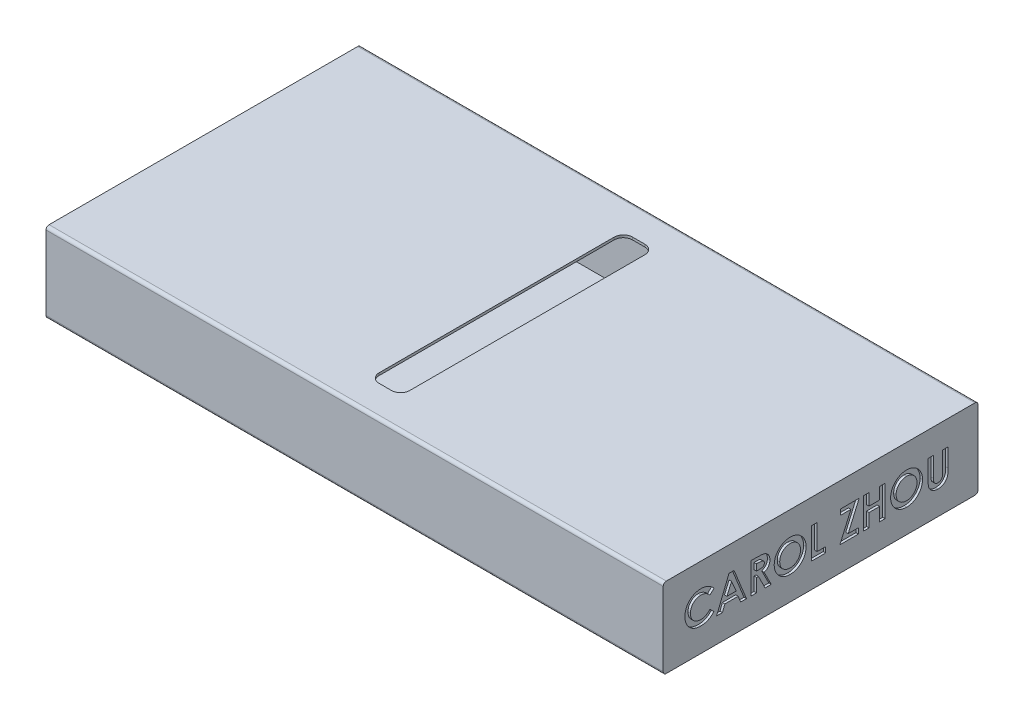
from build123d import *

# Parameters (mm, degrees)
SKETCH1_W           = 102.6
SKETCH1_H           = 26.1
BOSS_EXTRUDE1_DEPTH = 1.2
SKETCH2_W           = 102.6
SKETCH2_H           = 26.1
SKETCH2_W_2         = 101
SKETCH2_H_2         = 24.5
BOSS_EXTRUDE2_DEPTH = 200
CUT_EXTRUDE1_DEPTH  = 0.8
SKETCH4_W           = 10
SKETCH4_H           = 82.6
CUT_EXTRUDE3_DEPTH  = 0.8
FILLET1_R           = 3
FILLET2_R           = 1


with BuildPart() as part:
    # Sketch1 → Boss-Extrude1 (new body)
    with BuildSketch(Plane(origin=(0, 0, 0), x_dir=(0, 0, -1), z_dir=(1, 0, 0))):
        Rectangle(SKETCH1_W, SKETCH1_H)
    extrude(amount=BOSS_EXTRUDE1_DEPTH)

    # Sketch2 → Boss-Extrude2 (add)
    with BuildSketch(Plane.ZY):
        Rectangle(SKETCH2_W, SKETCH2_H)
        Rectangle(SKETCH2_W_2, SKETCH2_H_2, mode=Mode.SUBTRACT)
    extrude(amount=BOSS_EXTRUDE2_DEPTH)

    # Sketch3 → Cut-Extrude1 (cut)
    # profile 1 of 9: a face of its own
    with BuildSketch(Plane(origin=(1.2, 0, 0), x_dir=(0, 0, -1), z_dir=(1, 0, 0))):
        with BuildLine():
            Line((-34.743589744, 3.265224359), (-36.059695513, 2.007211538))
            add(Edge.make_bspline(
                [(-36.059695513, 2.007211538), (-36.171338326, 2.122650395), (-36.389411717, 2.348138647), (-36.740810017, 2.646665221), (-37.106251455, 2.895446728), (-37.478627096, 3.104968929), (-37.864634899, 3.263487407), (-38.259811562, 3.379002492), (-38.666680406, 3.449427674), (-38.94203359, 3.457485561), (-39.080528846, 3.461538462)],
                knots=[0, 0, 0, 0, 1.115251505, 2.178435587, 3.19620269, 4.182487026, 5.141301733, 6.088180966, 7.038406374, 8, 8, 8, 8], degree=3))
            add(Edge.make_bspline(
                [(-39.080528846, 3.461538462), (-39.196189215, 3.458336528), (-39.424432211, 3.452017866), (-39.759552739, 3.405695837), (-40.080112844, 3.32692321), (-40.387209853, 3.21835994), (-40.679940121, 3.077884829), (-40.958917392, 2.905606604), (-41.22345386, 2.70308118), (-41.470055151, 2.471356434), (-41.695637346, 2.218179736), (-41.894953579, 1.948040802), (-42.061912896, 1.661558508), (-42.198933692, 1.361634133), (-42.305667595, 1.046879481), (-42.381889012, 0.717506456), (-42.425973442, 0.3731228), (-42.432553339, 0.139013357), (-42.435897436, 0.020032051)],
                knots=[0, 0, 0, 0, 1.035432265, 2.043311493, 3.022114605, 3.98653278, 4.95457646, 5.923598177, 6.917315552, 7.932509744, 8.948865224, 9.949768934, 10.933144597, 11.912367597, 12.897413939, 13.903909035, 14.934704909, 16, 16, 16, 16], degree=3))
            add(Edge.make_bspline(
                [(-42.435897436, 0.020032051), (-42.434933705, -0.063477354), (-42.433034172, -0.228076108), (-42.412240426, -0.471563347), (-42.378757591, -0.707803533), (-42.330299632, -0.936438823), (-42.269702479, -1.157667356), (-42.198608221, -1.373397658), (-42.10942152, -1.580648823), (-42.010422936, -1.781827939), (-41.895288723, -1.971445581), (-41.771152803, -2.152261739), (-41.636547664, -2.323390071), (-41.490601462, -2.484130999), (-41.331260185, -2.631972502), (-41.162642217, -2.771360351), (-40.981903204, -2.898805194), (-40.792797554, -3.017505401), (-40.593691634, -3.120621281), (-40.389987649, -3.214024347), (-40.178597036, -3.289881523), (-39.962093602, -3.351029328), (-39.741251054, -3.403026403), (-39.513909348, -3.435042601), (-39.282039251, -3.459288092), (-39.125333984, -3.46078511), (-39.046474359, -3.461538462)],
                knots=[0, 0, 0, 0, 1.103660481, 2.175337485, 3.227646561, 4.255952547, 5.262355991, 6.258840057, 7.255597736, 8.242457506, 9.22035537, 10.185017736, 11.140346927, 12.096287581, 13.051739095, 14.01125915, 14.986044842, 15.97314143, 16.960198552, 17.947847494, 18.933482797, 19.925264591, 20.920966487, 21.929612487, 22.958107872, 24, 24, 24, 24], degree=3))
            add(Edge.make_bspline(
                [(-39.046474359, -3.461538462), (-38.912714882, -3.457669428), (-38.649912293, -3.450067782), (-38.264211705, -3.390623991), (-37.89667747, -3.292842318), (-37.603019375, -3.177367843), (-37.372946014, -3.063335301), (-37.197794566, -2.957860815), (-37.016674317, -2.839876021), (-36.83259352, -2.704928047), (-36.643481631, -2.554636322), (-36.452676911, -2.385709176), (-36.255294726, -2.203709139), (-36.125991613, -2.073812136), (-36.059695513, -2.007211538)],
                knots=[0, 0, 0, 0, 1.404581149, 2.759636711, 4.088442092, 5.392261763, 6.066678138, 6.783632037, 7.538459478, 8.336747902, 9.180226004, 10.074962426, 11.012997595, 12, 12, 12, 12], degree=3))
            Line((-36.059695513, -2.007211538), (-34.783653846, -3.347355769))
            add(Edge.make_bspline(
                [(-34.783653846, -3.347355769), (-34.873352707, -3.433957203), (-35.0484257, -3.602984682), (-35.312518451, -3.84298793), (-35.57627883, -4.058657528), (-35.833334937, -4.257821337), (-36.087897619, -4.434677233), (-36.339939879, -4.589401843), (-36.586608489, -4.725908376), (-36.833025603, -4.841894718), (-37.080724553, -4.940379168), (-37.335577665, -5.025167815), (-37.598364048, -5.09689596), (-37.870688681, -5.154771154), (-38.150011485, -5.201179245), (-38.438946552, -5.232504439), (-38.735661891, -5.253563324), (-38.936928502, -5.255455639), (-39.038461538, -5.256410256)],
                knots=[0, 0, 0, 0, 1.244526981, 2.429050516, 3.560637417, 4.644440555, 5.67424972, 6.652764056, 7.595344123, 8.486817594, 9.369275933, 10.254498637, 11.166417451, 12.086725134, 13.032340136, 13.991389299, 14.986715468, 16, 16, 16, 16], degree=3))
            add(Edge.make_bspline(
                [(-39.038461538, -5.256410256), (-39.22496515, -5.251655907), (-39.589900875, -5.242352968), (-40.124704666, -5.173424486), (-40.632753911, -5.057867099), (-41.115284599, -4.894437081), (-41.572143297, -4.685662892), (-42.003213126, -4.42971554), (-42.407799298, -4.127275036), (-42.782633552, -3.781886277), (-43.121688975, -3.400433388), (-43.421374703, -2.990857633), (-43.66927475, -2.551146098), (-43.8751115, -2.087794725), (-44.036073131, -1.598689064), (-44.149362832, -1.08330005), (-44.219227764, -0.542125324), (-44.226871087, -0.172490511), (-44.230769231, 0.016025641)],
                knots=[0, 0, 0, 0, 1.078019885, 2.10938526, 3.111377082, 4.085535484, 5.04941344, 6.010039228, 6.978205633, 7.964457913, 8.951525778, 9.924444315, 10.892603023, 11.863865945, 12.85144698, 13.863884204, 14.910567087, 16, 16, 16, 16], degree=3))
            add(Edge.make_bspline(
                [(-44.230769231, 0.016025641), (-44.229122064, 0.138974267), (-44.225857782, 0.382628395), (-44.191549875, 0.741550665), (-44.143722658, 1.091435677), (-44.067849127, 1.428650465), (-43.976391069, 1.757737934), (-43.862650958, 2.075121288), (-43.726810452, 2.381712718), (-43.573248011, 2.678025477), (-43.399524357, 2.9621184), (-43.205455965, 3.231550678), (-42.996038911, 3.488402282), (-42.766241245, 3.729265596), (-42.519402228, 3.956255449), (-42.25440741, 4.168141738), (-41.972850603, 4.367963151), (-41.673969737, 4.55056678), (-41.36357127, 4.715741469), (-41.045570145, 4.861432598), (-40.720747653, 4.983196833), (-40.390477173, 5.084195773), (-40.053363316, 5.159584341), (-39.711812316, 5.216651054), (-39.362917984, 5.248551712), (-39.128665666, 5.253774054), (-39.010416667, 5.256410256)],
                knots=[0, 0, 0, 0, 1.071919942, 2.124283339, 3.142214191, 4.149696895, 5.136002878, 6.119640489, 7.086990633, 8.058538607, 9.028339693, 9.988281803, 10.952401235, 11.916291999, 12.888973767, 13.874849856, 14.873389453, 15.898127285, 16.927174885, 17.938320013, 18.946391617, 19.950418109, 20.947802303, 21.956882652, 22.968648068, 24, 24, 24, 24], degree=3))
            add(Edge.make_bspline(
                [(-39.010416667, 5.256410256), (-38.909538146, 5.254899119), (-38.70882996, 5.251892556), (-38.409941792, 5.226829583), (-38.113443991, 5.187468438), (-37.820398111, 5.128080852), (-37.528707988, 5.057580283), (-37.242206757, 4.965269512), (-36.956374706, 4.862371762), (-36.675694687, 4.739378512), (-36.399774911, 4.60512027), (-36.135079234, 4.452799419), (-35.87716344, 4.291789614), (-35.631742787, 4.112561589), (-35.394220019, 3.921616277), (-35.165837163, 3.718062813), (-34.948598413, 3.498507361), (-34.812271434, 3.343378474), (-34.743589744, 3.265224359)],
                knots=[0, 0, 0, 0, 0.996412454, 1.982464992, 2.961075852, 3.949442424, 4.934965278, 5.923860011, 6.921385422, 7.934793307, 8.949617135, 9.951082467, 10.950285876, 11.951772932, 12.951063433, 13.960125323, 14.972308753, 16, 16, 16, 16], degree=3))
        make_face()
    # profile 2 of 9: a face of its own
    with BuildSketch(Plane(origin=(1.2, 0, 0), x_dir=(0, 0, -1), z_dir=(1, 0, 0))):
        Polygon((-29.869791667, 5), (-28.205128205, 5), (-24.166666667, -5), (-26.083733974, -5), (-26.860977564, -2.948717949), (-31.217948718, -2.948717949), (-31.995192308, -5), (-33.91025641, -5), align=None)
        Polygon((-29.038461538, 2.317708333), (-30.536858974, -1.153846154), (-27.540064103, -1.153846154), align=None, mode=Mode.SUBTRACT)
    # profile 3 of 9: a face of its own
    with BuildSketch(Plane(origin=(1.2, 0, 0), x_dir=(0, 0, -1), z_dir=(1, 0, 0))):
        with BuildLine():
            Line((-22.692307692, 5), (-20.600961538, 5))
            add(Edge.make_bspline(
                [(-20.600961538, 5), (-20.462724194, 4.999509337), (-20.196854842, 4.998565653), (-19.813485758, 4.983676825), (-19.461308532, 4.9629578), (-19.139801734, 4.931340016), (-18.849102911, 4.889418657), (-18.588920713, 4.840000312), (-18.359262747, 4.783677513), (-18.158192164, 4.713494862), (-17.976735905, 4.634329895), (-17.807593445, 4.543367897), (-17.647033248, 4.441621757), (-17.496128488, 4.32641426), (-17.353567765, 4.19981796), (-17.219082131, 4.061705426), (-17.094571991, 3.91090552), (-16.980808319, 3.748371106), (-16.877121889, 3.577388629), (-16.785484832, 3.39772333), (-16.710965425, 3.209250263), (-16.64511954, 3.014693272), (-16.597692882, 2.811271126), (-16.564708336, 2.600964175), (-16.540558341, 2.383032114), (-16.539169832, 2.234978749), (-16.538461538, 2.159455128)],
                knots=[0, 0, 0, 0, 1.749336639, 3.364467119, 4.854658419, 6.213483162, 7.451590619, 8.570285859, 9.5643256, 10.440900261, 11.26203566, 12.067320669, 12.869050712, 13.665104639, 14.467235401, 15.27997916, 16.102287765, 16.939272006, 17.78853747, 18.631303466, 19.488103222, 20.351255419, 21.228522269, 22.127379805, 23.044756219, 24, 24, 24, 24], degree=3))
            add(Edge.make_bspline(
                [(-16.538461538, 2.159455128), (-16.54030143, 2.080625818), (-16.543909123, 1.926055908), (-16.563342119, 1.699005317), (-16.598859531, 1.481779192), (-16.652655818, 1.275013547), (-16.714487663, 1.07613494), (-16.796708156, 0.888812806), (-16.889502108, 0.710322818), (-16.999710775, 0.543189782), (-17.120659402, 0.383701341), (-17.261320111, 0.237968087), (-17.412580249, 0.098157412), (-17.582942698, -0.026973419), (-17.764897725, -0.145885301), (-17.962060583, -0.253651133), (-18.173144521, -0.352979901), (-18.321546983, -0.408372483), (-18.397435897, -0.436698718)],
                knots=[0, 0, 0, 0, 1.099860209, 2.156625411, 3.176576793, 4.16617041, 5.135385252, 6.078461593, 7.016046972, 7.938469504, 8.868247731, 9.803980173, 10.76021508, 11.73834243, 12.748633912, 13.790971185, 14.870363756, 16, 16, 16, 16], degree=3))
            Line((-18.397435897, -0.436698718), (-16.08974359, -5))
            Line((-16.08974359, -5), (-18.084935897, -5))
            Line((-18.084935897, -5), (-20.288461538, -0.641025641))
            Line((-20.288461538, -0.641025641), (-20.897435897, -0.641025641))
            Line((-20.897435897, -0.641025641), (-20.897435897, -5))
            Line((-20.897435897, -5), (-22.692307692, -5))
            Line((-22.692307692, -5), (-22.692307692, 5))
        make_face()
        with BuildLine():
            Line((-20.897435897, 1.153846154), (-20.198317308, 1.153846154))
            add(Edge.make_bspline(
                [(-20.198317308, 1.153846154), (-20.112844249, 1.154808809), (-19.949181707, 1.156652086), (-19.713813475, 1.165201972), (-19.500042989, 1.185802971), (-19.306952245, 1.211831563), (-19.133569628, 1.241885331), (-18.98144165, 1.284954206), (-18.848224252, 1.331103596), (-18.735496063, 1.388455316), (-18.63918369, 1.453676661), (-18.556024119, 1.52776973), (-18.487239231, 1.613523023), (-18.430625759, 1.708606135), (-18.386586633, 1.813860053), (-18.354441445, 1.928129328), (-18.336477039, 2.052715634), (-18.334410172, 2.138697148), (-18.333333333, 2.18349359)],
                knots=[0, 0, 0, 0, 1.688639943, 3.233382647, 4.650958383, 5.928841754, 7.082724185, 8.122798841, 9.049171256, 9.863274652, 10.613301712, 11.341792392, 12.054588806, 12.776240173, 13.521029143, 14.301969904, 15.115324896, 16, 16, 16, 16], degree=3))
            add(Edge.make_bspline(
                [(-18.333333333, 2.18349359), (-18.335369196, 2.23649105), (-18.339368271, 2.34059474), (-18.379051521, 2.49046755), (-18.442218683, 2.62918509), (-18.528803561, 2.7561206), (-18.637845958, 2.86740103), (-18.762980712, 2.965495615), (-18.906908532, 3.043061474), (-19.040174863, 3.094223088), (-19.161416075, 3.12483361), (-19.270832443, 3.1476443), (-19.397537256, 3.16381089), (-19.541626169, 3.180958437), (-19.702731895, 3.192077754), (-19.881732556, 3.200192638), (-20.078114064, 3.203512836), (-20.215010626, 3.204574245), (-20.286458333, 3.205128205)],
                knots=[0, 0, 0, 0, 1.020303359, 2.004196876, 2.966617323, 3.9489082, 4.950758222, 5.960522915, 7.003732012, 8.091992268, 8.70421221, 9.413913587, 10.24622431, 11.166358409, 12.212345909, 13.359657661, 14.621978493, 16, 16, 16, 16], degree=3))
            Line((-20.286458333, 3.205128205), (-20.897435897, 3.205128205))
            Line((-20.897435897, 3.205128205), (-20.897435897, 1.153846154))
        make_face(mode=Mode.SUBTRACT)
    # profile 4 of 9: a face of its own
    with BuildSketch(Plane(origin=(1.2, 0, 0), x_dir=(0, 0, -1), z_dir=(1, 0, 0))):
        with BuildLine():
            add(Edge.make_bspline(
                [(-9.915865385, 5.256410256), (-9.742003129, 5.251908651), (-9.398759657, 5.243021463), (-8.893972374, 5.168939814), (-8.407516492, 5.048234387), (-7.939611985, 4.880445112), (-7.491430432, 4.661027405), (-7.061390947, 4.3962019), (-6.65103391, 4.080970175), (-6.264564332, 3.722686066), (-5.90739674, 3.333067742), (-5.597910814, 2.913574347), (-5.333992569, 2.475075377), (-5.115256422, 2.016395861), (-4.948648133, 1.534359225), (-4.831732205, 1.031423218), (-4.756619513, 0.507730921), (-4.747980398, 0.151167846), (-4.743589744, -0.030048077)],
                knots=[0, 0, 0, 0, 1.014329547, 2.002516266, 2.970391464, 3.935626869, 4.897733899, 5.877609409, 6.878433252, 7.912639331, 8.949961323, 9.958554974, 10.949718813, 11.932905612, 12.9188844, 13.919928257, 14.942845884, 16, 16, 16, 16], degree=3))
            add(Edge.make_bspline(
                [(-4.743589744, -0.030048077), (-4.748265601, -0.209222115), (-4.757479527, -0.562290307), (-4.828665776, -1.081156573), (-4.947550583, -1.578705088), (-5.111333065, -2.056062063), (-5.326102165, -2.510915345), (-5.584873716, -2.946169109), (-5.894476208, -3.357784097), (-6.243617221, -3.745539419), (-6.627991176, -4.097510576), (-7.035104214, -4.407684552), (-7.463076537, -4.670514273), (-7.911281731, -4.885879352), (-8.380680949, -5.053016258), (-8.87011472, -5.17094349), (-9.379552756, -5.24261025), (-9.725995325, -5.251763992), (-9.901842949, -5.256410256)],
                knots=[0, 0, 0, 0, 1.051557043, 2.072126891, 3.067553643, 4.050577992, 5.02905126, 6.015227836, 7.017913613, 8.04756643, 9.074058332, 10.072836633, 11.047628519, 12.017157415, 12.98668631, 13.966869689, 14.968021931, 16, 16, 16, 16], degree=3))
            add(Edge.make_bspline(
                [(-9.901842949, -5.256410256), (-10.085758478, -5.252242328), (-10.447127354, -5.244052919), (-10.975992322, -5.166175379), (-11.482690659, -5.048864597), (-11.962965808, -4.873784549), (-12.421708959, -4.654919768), (-12.855549593, -4.385374667), (-13.264341911, -4.065594692), (-13.645741013, -3.703769526), (-13.991289523, -3.307853434), (-14.296303862, -2.889603193), (-14.553590224, -2.452213866), (-14.763158021, -1.995480745), (-14.928372854, -1.522242317), (-15.044913147, -1.029616422), (-15.113756279, -0.518784556), (-15.123345727, -0.171817341), (-15.128205128, 0.00400641)],
                knots=[0, 0, 0, 0, 1.067978421, 2.098431617, 3.099715153, 4.085208694, 5.062210972, 6.048429807, 7.046490867, 8.072918869, 9.098532598, 10.095778865, 11.076610158, 12.041847152, 13.011192615, 13.984257998, 14.978533688, 16, 16, 16, 16], degree=3))
            add(Edge.make_bspline(
                [(-15.128205128, 0.00400641), (-15.126679968, 0.122291426), (-15.12364896, 0.357363698), (-15.087137277, 0.705728805), (-15.034570951, 1.047294294), (-14.956827849, 1.380698337), (-14.86238985, 1.708292944), (-14.740032082, 2.027028784), (-14.600755829, 2.340310833), (-14.438024641, 2.644438837), (-14.257083295, 2.936614564), (-14.059660177, 3.21545977), (-13.845258868, 3.47760281), (-13.614570027, 3.724766378), (-13.366798669, 3.955325852), (-13.10520397, 4.172545122), (-12.824712516, 4.370654071), (-12.531463385, 4.554490915), (-12.227109847, 4.720731384), (-11.912890899, 4.862230301), (-11.595280071, 4.985798894), (-11.270034511, 5.083324691), (-10.940639803, 5.162758433), (-10.603577032, 5.21528933), (-10.261891369, 5.251800002), (-10.031481109, 5.254869858), (-9.915865385, 5.256410256)],
                knots=[0, 0, 0, 0, 1.034744296, 2.056386356, 3.06226378, 4.057406941, 5.050368692, 6.043467995, 7.042652155, 8.049140477, 9.059438543, 10.048523776, 11.036952808, 12.020949711, 13.004946614, 13.997082645, 14.994316842, 16.007702937, 17.024872941, 18.026463647, 19.021641123, 20.005082605, 20.995858141, 21.984425357, 22.988620895, 24, 24, 24, 24], degree=3))
        make_face()
        with BuildLine():
            add(Edge.make_bspline(
                [(-9.943910256, 3.461538462), (-10.060919531, 3.45839884), (-10.291849017, 3.452202483), (-10.630580518, 3.404994627), (-10.95577472, 3.329598314), (-11.265628945, 3.220387676), (-11.561486127, 3.081390252), (-11.843870729, 2.913091715), (-12.10887231, 2.709706992), (-12.360024408, 2.482154901), (-12.586899, 2.228609577), (-12.78734986, 1.956892643), (-12.955094944, 1.667457861), (-13.095582502, 1.362994012), (-13.201338497, 1.04007748), (-13.276665321, 0.701237706), (-13.324269063, 0.345890852), (-13.330269573, 0.103651364), (-13.333333333, -0.020032051)],
                knots=[0, 0, 0, 0, 1.033739768, 2.040188636, 3.016340934, 3.979330865, 4.937572243, 5.900995986, 6.878200029, 7.884839167, 8.891893314, 9.879764717, 10.863503415, 11.843163062, 12.837761627, 13.859916423, 14.907309254, 16, 16, 16, 16], degree=3))
            add(Edge.make_bspline(
                [(-13.333333333, -0.020032051), (-13.329271255, -0.157101098), (-13.321310255, -0.425733719), (-13.265295691, -0.817607748), (-13.169460349, -1.187693874), (-13.031075977, -1.534182063), (-12.85944305, -1.860919806), (-12.646302195, -2.163902467), (-12.395105284, -2.444944165), (-12.201585219, -2.609028015), (-12.103365385, -2.692307692)],
                knots=[0, 0, 0, 0, 1.078454662, 2.113592447, 3.107694534, 4.079536787, 5.043276885, 6.005368276, 6.987637804, 8, 8, 8, 8], degree=3))
            add(Edge.make_bspline(
                [(-12.103365385, -2.692307692), (-12.022904589, -2.753831519), (-11.863795793, -2.875493031), (-11.609823513, -3.031427217), (-11.348282075, -3.165078369), (-11.07719782, -3.273066919), (-10.797143263, -3.358008897), (-10.50815681, -3.417492368), (-10.210647929, -3.45482339), (-10.009458482, -3.459285154), (-9.907852564, -3.461538462)],
                knots=[0, 0, 0, 0, 1.023928204, 2.024787132, 3.009472467, 3.9914905, 4.972207045, 5.96565515, 6.972602802, 8, 8, 8, 8], degree=3))
            add(Edge.make_bspline(
                [(-9.907852564, -3.461538462), (-9.792855266, -3.458372219), (-9.566594466, -3.452142539), (-9.234168636, -3.405515837), (-8.915694594, -3.326606622), (-8.609195227, -3.218354019), (-8.315554341, -3.077611362), (-8.03620704, -2.904092732), (-7.770663552, -2.699928716), (-7.519831418, -2.469388368), (-7.290558991, -2.214844251), (-7.090526431, -1.941678006), (-6.917447892, -1.655908305), (-6.779881775, -1.353490509), (-6.669947599, -1.037279301), (-6.595527372, -0.70587425), (-6.547521487, -0.360641534), (-6.541519286, -0.12569847), (-6.538461538, -0.006009615)],
                knots=[0, 0, 0, 0, 1.026359118, 2.019393844, 2.989460624, 3.950973911, 4.916101784, 5.890408035, 6.881132271, 7.902007068, 8.92769091, 9.933912415, 10.920395702, 11.90457117, 12.894218921, 13.903490204, 14.931958862, 16, 16, 16, 16], degree=3))
            add(Edge.make_bspline(
                [(-6.538461538, -0.006009615), (-6.541625085, 0.112990996), (-6.547852043, 0.34722555), (-6.594560811, 0.691570675), (-6.672969603, 1.02151267), (-6.781547278, 1.337590364), (-6.920195219, 1.640113631), (-7.091647463, 1.928018619), (-7.295302407, 2.201026997), (-7.526472943, 2.457278314), (-7.778087863, 2.692756861), (-8.048221622, 2.897109434), (-8.329315572, 3.074685323), (-8.627819381, 3.213791104), (-8.937625911, 3.324616384), (-9.260625617, 3.406229711), (-9.598041881, 3.451870846), (-9.827593142, 3.458287198), (-9.943910256, 3.461538462)],
                knots=[0, 0, 0, 0, 1.055025985, 2.07665775, 3.074803781, 4.057872707, 5.035505728, 6.020516407, 7.023567878, 8.050795229, 9.077271434, 10.074415901, 11.050397877, 12.019801805, 12.988065821, 13.964604439, 14.968634123, 16, 16, 16, 16], degree=3))
        make_face(mode=Mode.SUBTRACT)
    # profile 5 of 9: a face of its own
    with BuildSketch(Plane(origin=(1.2, 0, 0), x_dir=(0, 0, -1), z_dir=(1, 0, 0))):
        Polygon((-2.948717949, 5), (-1.153846154, 5), (-1.153846154, -3.205128205), (1.666666667, -3.205128205), (1.666666667, -5), (-2.948717949, -5), align=None)
    # profile 6 of 9: a face of its own
    with BuildSketch(Plane(origin=(1.2, 0, 0), x_dir=(0, 0, -1), z_dir=(1, 0, 0))):
        Polygon((6.538461538, 5), (12.564102564, 5), (8.982371795, -3.205128205), (12.307692308, -3.205128205), (12.307692308, -5), (6.282051282, -5), (9.865785256, 3.205128205), (6.538461538, 3.205128205), align=None)
    # profile 7 of 9: a face of its own
    with BuildSketch(Plane(origin=(1.2, 0, 0), x_dir=(0, 0, -1), z_dir=(1, 0, 0))):
        Polygon((13.974358974, 5), (15.769230769, 5), (15.769230769, 1.153846154), (19.230769231, 1.153846154), (19.230769231, 5), (21.025641026, 5), (21.025641026, -5), (19.230769231, -5), (19.230769231, -0.641025641), (15.769230769, -0.641025641), (15.769230769, -5), (13.974358974, -5), align=None)
    # profile 8 of 9: a face of its own
    with BuildSketch(Plane(origin=(1.2, 0, 0), x_dir=(0, 0, -1), z_dir=(1, 0, 0))):
        with BuildLine():
            add(Edge.make_bspline(
                [(28.032852564, 5.256410256), (28.20671482, 5.251908651), (28.549958291, 5.243021463), (29.054745574, 5.168939814), (29.541201457, 5.048234387), (30.009105964, 4.880445112), (30.457287517, 4.661027405), (30.887327002, 4.3962019), (31.297684039, 4.080970175), (31.684153617, 3.722686066), (32.041321209, 3.333067742), (32.350807135, 2.913574347), (32.614725379, 2.475075377), (32.833461527, 2.016395861), (33.000069816, 1.534359225), (33.116985744, 1.031423218), (33.192098436, 0.507730921), (33.200737551, 0.151167846), (33.205128205, -0.030048077)],
                knots=[0, 0, 0, 0, 1.014329547, 2.002516266, 2.970391464, 3.935626869, 4.897733899, 5.877609409, 6.878433252, 7.912639331, 8.949961323, 9.958554974, 10.949718813, 11.932905612, 12.9188844, 13.919928257, 14.942845884, 16, 16, 16, 16], degree=3))
            add(Edge.make_bspline(
                [(33.205128205, -0.030048077), (33.200452348, -0.209222115), (33.191238422, -0.562290307), (33.120052173, -1.081156573), (33.001167366, -1.578705088), (32.837384884, -2.056062063), (32.622615784, -2.510915345), (32.363844232, -2.946169109), (32.054241741, -3.357784097), (31.705100728, -3.745539419), (31.320726772, -4.097510576), (30.913613735, -4.407684552), (30.485641412, -4.670514273), (30.037436218, -4.885879352), (29.568036999, -5.053016258), (29.078603229, -5.17094349), (28.569165193, -5.24261025), (28.222722624, -5.251763992), (28.046875, -5.256410256)],
                knots=[0, 0, 0, 0, 1.051557043, 2.072126891, 3.067553643, 4.050577992, 5.02905126, 6.015227836, 7.017913613, 8.04756643, 9.074058332, 10.072836633, 11.047628519, 12.017157415, 12.98668631, 13.966869689, 14.968021931, 16, 16, 16, 16], degree=3))
            add(Edge.make_bspline(
                [(28.046875, -5.256410256), (27.862959471, -5.252242328), (27.501590594, -5.244052919), (26.972725627, -5.166175379), (26.466027289, -5.048864597), (25.985752141, -4.873784549), (25.527008989, -4.654919768), (25.093168355, -4.385374667), (24.684376037, -4.065594692), (24.302976936, -3.703769526), (23.957428426, -3.307853434), (23.652414086, -2.889603193), (23.395127725, -2.452213866), (23.185559928, -1.995480745), (23.020345095, -1.522242317), (22.903804802, -1.029616422), (22.83496167, -0.518784556), (22.825372221, -0.171817341), (22.820512821, 0.00400641)],
                knots=[0, 0, 0, 0, 1.067978421, 2.098431617, 3.099715153, 4.085208694, 5.062210972, 6.048429807, 7.046490867, 8.072918869, 9.098532598, 10.095778865, 11.076610158, 12.041847152, 13.011192615, 13.984257998, 14.978533688, 16, 16, 16, 16], degree=3))
            add(Edge.make_bspline(
                [(22.820512821, 0.00400641), (22.82203798, 0.122291426), (22.825068988, 0.357363698), (22.861580671, 0.705728805), (22.914146998, 1.047294294), (22.9918901, 1.380698337), (23.086328099, 1.708292944), (23.208685867, 2.027028784), (23.347962119, 2.340310833), (23.510693307, 2.644438837), (23.691634654, 2.936614564), (23.889057772, 3.21545977), (24.103459081, 3.47760281), (24.334147921, 3.724766378), (24.58191928, 3.955325852), (24.843513979, 4.172545122), (25.124005433, 4.370654071), (25.417254564, 4.554490915), (25.721608101, 4.720731384), (26.035827049, 4.862230301), (26.353437878, 4.985798894), (26.678683438, 5.083324691), (27.008078146, 5.162758433), (27.345140916, 5.21528933), (27.686826579, 5.251800002), (27.91723684, 5.254869858), (28.032852564, 5.256410256)],
                knots=[0, 0, 0, 0, 1.034744296, 2.056386356, 3.06226378, 4.057406941, 5.050368692, 6.043467995, 7.042652155, 8.049140477, 9.059438543, 10.048523776, 11.036952808, 12.020949711, 13.004946614, 13.997082645, 14.994316842, 16.007702937, 17.024872941, 18.026463647, 19.021641123, 20.005082605, 20.995858141, 21.984425357, 22.988620895, 24, 24, 24, 24], degree=3))
        make_face()
        with BuildLine():
            add(Edge.make_bspline(
                [(28.004807692, 3.461538462), (27.887798417, 3.45839884), (27.656868931, 3.452202483), (27.318137431, 3.404994627), (26.992943229, 3.329598314), (26.683089004, 3.220387676), (26.387231822, 3.081390252), (26.104847219, 2.913091715), (25.839845639, 2.709706992), (25.588693541, 2.482154901), (25.361818948, 2.228609577), (25.161368089, 1.956892643), (24.993623005, 1.667457861), (24.853135447, 1.362994012), (24.747379452, 1.04007748), (24.672052627, 0.701237706), (24.624448886, 0.345890852), (24.618448375, 0.103651364), (24.615384615, -0.020032051)],
                knots=[0, 0, 0, 0, 1.033739768, 2.040188636, 3.016340934, 3.979330865, 4.937572243, 5.900995986, 6.878200029, 7.884839167, 8.891893314, 9.879764717, 10.863503415, 11.843163062, 12.837761627, 13.859916423, 14.907309254, 16, 16, 16, 16], degree=3))
            add(Edge.make_bspline(
                [(24.615384615, -0.020032051), (24.619446693, -0.157101098), (24.627407693, -0.425733719), (24.683422257, -0.817607748), (24.7792576, -1.187693874), (24.917641972, -1.534182063), (25.089274899, -1.860919806), (25.302415754, -2.163902467), (25.553612665, -2.444944165), (25.74713273, -2.609028015), (25.845352564, -2.692307692)],
                knots=[0, 0, 0, 0, 1.078454662, 2.113592447, 3.107694534, 4.079536787, 5.043276885, 6.005368276, 6.987637804, 8, 8, 8, 8], degree=3))
            add(Edge.make_bspline(
                [(25.845352564, -2.692307692), (25.92581336, -2.753831519), (26.084922156, -2.875493031), (26.338894435, -3.031427217), (26.600435874, -3.165078369), (26.871520129, -3.273066919), (27.151574685, -3.358008897), (27.440561139, -3.417492368), (27.738070019, -3.45482339), (27.939259467, -3.459285154), (28.040865385, -3.461538462)],
                knots=[0, 0, 0, 0, 1.023928204, 2.024787132, 3.009472467, 3.9914905, 4.972207045, 5.96565515, 6.972602802, 8, 8, 8, 8], degree=3))
            add(Edge.make_bspline(
                [(28.040865385, -3.461538462), (28.155862682, -3.458372219), (28.382123482, -3.452142539), (28.714549312, -3.405515837), (29.033023354, -3.326606622), (29.339522722, -3.218354019), (29.633163608, -3.077611362), (29.912510909, -2.904092732), (30.178054397, -2.699928716), (30.42888653, -2.469388368), (30.658158957, -2.214844251), (30.858191518, -1.941678006), (31.031270057, -1.655908305), (31.168836174, -1.353490509), (31.278770349, -1.037279301), (31.353190576, -0.70587425), (31.401196461, -0.360641534), (31.407198663, -0.12569847), (31.41025641, -0.006009615)],
                knots=[0, 0, 0, 0, 1.026359118, 2.019393844, 2.989460624, 3.950973911, 4.916101784, 5.890408035, 6.881132271, 7.902007068, 8.92769091, 9.933912415, 10.920395702, 11.90457117, 12.894218921, 13.903490204, 14.931958862, 16, 16, 16, 16], degree=3))
            add(Edge.make_bspline(
                [(31.41025641, -0.006009615), (31.407092864, 0.112990996), (31.400865906, 0.34722555), (31.354157138, 0.691570675), (31.275748346, 1.02151267), (31.167170671, 1.337590364), (31.02852273, 1.640113631), (30.857070485, 1.928018619), (30.653415542, 2.201026997), (30.422245006, 2.457278314), (30.170630085, 2.692756861), (29.900496327, 2.897109434), (29.619402376, 3.074685323), (29.320898567, 3.213791104), (29.011092038, 3.324616384), (28.688092331, 3.406229711), (28.350676067, 3.451870846), (28.121124806, 3.458287198), (28.004807692, 3.461538462)],
                knots=[0, 0, 0, 0, 1.055025985, 2.07665775, 3.074803781, 4.057872707, 5.035505728, 6.020516407, 7.023567878, 8.050795229, 9.077271434, 10.074415901, 11.050397877, 12.019801805, 12.988065821, 13.964604439, 14.968634123, 16, 16, 16, 16], degree=3))
        make_face(mode=Mode.SUBTRACT)
    # profile 9 of 9: a face of its own
    with BuildSketch(Plane(origin=(1.2, 0, 0), x_dir=(0, 0, -1), z_dir=(1, 0, 0))):
        with BuildLine():
            Line((35, 5), (36.794871795, 5))
            Line((36.794871795, 5), (36.794871795, -1.506410256))
            add(Edge.make_bspline(
                [(36.794871795, -1.506410256), (36.794969391, -1.573865896), (36.795157897, -1.704155767), (36.804594616, -1.891079074), (36.813229864, -2.062900731), (36.828810303, -2.219432629), (36.851827951, -2.360741728), (36.874116546, -2.487735747), (36.904281954, -2.598141002), (36.94961574, -2.723811087), (37.019460223, -2.865008291), (37.133582232, -3.012167256), (37.265269268, -3.146471171), (37.423103765, -3.258260662), (37.600495782, -3.348688284), (37.796470628, -3.415685144), (38.010752048, -3.452926503), (38.158915895, -3.458612078), (38.235176282, -3.461538462)],
                knots=[0, 0, 0, 0, 1.155499968, 2.231836252, 3.205919964, 4.102923608, 4.924856345, 5.658536265, 6.31071849, 6.882491295, 7.94666036, 8.992281882, 10.060072772, 11.158554251, 12.289267114, 13.461410017, 14.693379945, 16, 16, 16, 16], degree=3))
            add(Edge.make_bspline(
                [(38.235176282, -3.461538462), (38.316193532, -3.45917432), (38.474163454, -3.454564643), (38.701378037, -3.409315677), (38.911893638, -3.337263827), (39.101252921, -3.234427475), (39.269267446, -3.111160083), (39.41148822, -2.970596629), (39.523728332, -2.812456758), (39.596882262, -2.666560684), (39.637954591, -2.532276053), (39.668740347, -2.412297831), (39.691309713, -2.270735405), (39.711785383, -2.109799578), (39.724089683, -1.927823364), (39.737431691, -1.72627024), (39.74232166, -1.503761125), (39.74315512, -1.348823853), (39.743589744, -1.268028846)],
                knots=[0, 0, 0, 0, 1.261321664, 2.459363699, 3.594844139, 4.716940403, 5.803436589, 6.833651888, 7.818396249, 8.814403945, 9.360733334, 10.004355033, 10.743453831, 11.592799886, 12.532235708, 13.585170094, 14.740740724, 16, 16, 16, 16], degree=3))
            Line((39.743589744, -1.268028846), (39.743589744, 5))
            Line((39.743589744, 5), (41.538461538, 5))
            Line((41.538461538, 5), (41.538461538, -0.965544872))
            add(Edge.make_bspline(
                [(41.538461538, -0.965544872), (41.538212288, -1.086406526), (41.537733003, -1.318811699), (41.530372638, -1.652794288), (41.514703751, -1.95783381), (41.501543693, -2.234019397), (41.476074475, -2.48097898), (41.449541524, -2.699767148), (41.415722995, -2.889608566), (41.365403058, -3.105719949), (41.278565744, -3.354564292), (41.138572609, -3.641097766), (40.960860385, -3.921631393), (40.750813418, -4.19307911), (40.513651178, -4.445245291), (40.254632061, -4.666614558), (39.977871235, -4.853869087), (39.680476749, -5.002430279), (39.362701701, -5.118296809), (39.021401943, -5.196153281), (38.656810216, -5.248754091), (38.404979819, -5.253807046), (38.275240385, -5.256410256)],
                knots=[0, 0, 0, 0, 1.170808336, 2.251350247, 3.235597562, 4.129743112, 4.929140599, 5.639994148, 6.264258765, 6.79612947, 7.788252245, 8.809469599, 9.879094798, 10.999557536, 12.129761673, 13.226370002, 14.293821979, 15.358369427, 16.438775801, 17.562147481, 18.744053101, 20, 20, 20, 20], degree=3))
            add(Edge.make_bspline(
                [(38.275240385, -5.256410256), (38.189038923, -5.254958307), (38.018965209, -5.25209364), (37.768841976, -5.226834759), (37.527048737, -5.189612666), (37.294039821, -5.135309465), (37.069006497, -5.065159873), (36.852008551, -4.97881061), (36.643852399, -4.876743322), (36.445702855, -4.759896806), (36.257803759, -4.633547415), (36.086073684, -4.493483795), (35.924602995, -4.350064182), (35.778056514, -4.197252868), (35.645333545, -4.036654112), (35.526707433, -3.867903945), (35.422354415, -3.691017355), (35.329649549, -3.502805972), (35.250303231, -3.293703692), (35.183411305, -3.056272659), (35.124972944, -2.78679138), (35.081545003, -2.484652727), (35.042172976, -2.150852516), (35.017252653, -1.784521146), (35.004215711, -1.385648107), (35.001440745, -1.109117698), (35, -0.965544872)],
                knots=[0, 0, 0, 0, 1.001158378, 1.975264943, 2.917723546, 3.841610987, 4.75185031, 5.653588123, 6.552117133, 7.442167995, 8.324307438, 9.179605724, 10.014504199, 10.831958861, 11.636465792, 12.43274043, 13.225645099, 14.020104002, 14.867201867, 15.819789774, 16.883317127, 18.068162734, 19.364263498, 20.787406516, 22.332041935, 24, 24, 24, 24], degree=3))
            Line((35, -0.965544872), (35, 5))
        make_face()
    extrude(amount=-CUT_EXTRUDE1_DEPTH, mode=Mode.SUBTRACT)

    # Sketch4 → Cut-Extrude3 (cut)
    with BuildSketch(Plane(origin=(0, 13.05, 0), x_dir=(1, 0, 0), z_dir=(0, 1, 0))):
        with Locations((-99.4, 0)):
            Rectangle(SKETCH4_W, SKETCH4_H)
    extrude(amount=-CUT_EXTRUDE3_DEPTH, mode=Mode.SUBTRACT)

    # Fillet1
    fillet1_edges = [part.edges().sort_by_distance(p)[0] for p in [
        (-94.4, 12.65, -41.3),
        (-94.4, 12.65, 41.3),
        (-104.4, 12.65, 41.3),
        (-104.4, 12.65, -41.3),
    ]]
    fillet(fillet1_edges, radius=FILLET1_R)

    # Fillet2
    fillet2_edges = [part.edges().sort_by_distance(p)[0] for p in [
        (-99.4, 13.05, 51.3),
        (-99.4, 13.05, -51.3),
        (-99.4, -13.05, -51.3),
        (-99.4, -13.05, 51.3),
    ]]
    fillet(fillet2_edges, radius=FILLET2_R)


solid = part.part
